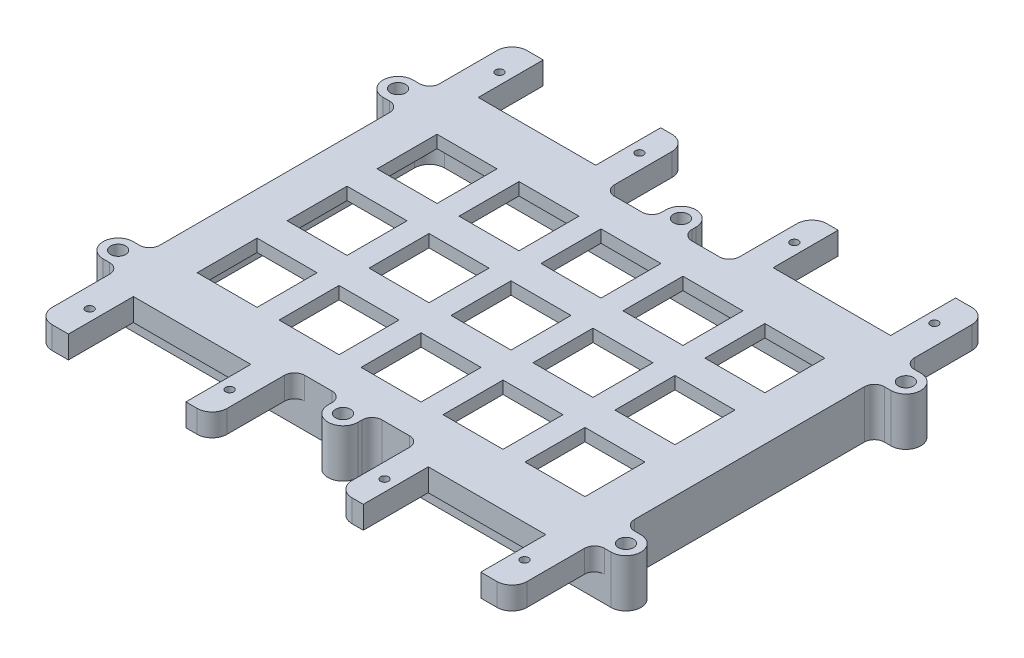
from build123d import *

# Parameters (mm, degrees)
SKETCH_1_R          = 1.5
SKETCH_1_R_2        = 0.8
EXTRUDE_1_DEPTH     = 9.6
CUT_EXTRUDE_START   = -5.1
CUT_EXTRUDE_1_DEPTH = 5.1
SKETCH_3_W          = 90
SKETCH_3_H          = 57
CUT_EXTRUDE_2_DEPTH = 7.1
FILLET_1_R          = 3
FILLET_2_R          = 1
SKETCH_13_W         = 12
SKETCH_13_H         = 12
CUT_EXTRUDE_3_DEPTH = 73.118652234


with BuildPart() as part:
    # 草图1 → 凸台-拉伸1 (new body)
    with BuildSketch(Plane(origin=(0, 0, 0), x_dir=(1, 0, 0), z_dir=(0, 1, 0))):
        with BuildLine():
            Line((-47.5, 23), (-47.5, -23))
            ThreePointArc((-47.5, -23), (-48.085786438, -24.414213562), (-49.5, -25))
            Line((-49.5, -25), (-50.8, -25))
            ThreePointArc((-50.8, -25), (-53.8, -28), (-50.8, -31))
            Line((-50.8, -31), (-49.5, -31))
            ThreePointArc((-49.5, -31), (-48.085786438, -31.585786438), (-47.5, -33))
            Line((-47.5, -33), (-47.5, -44.5))
            ThreePointArc((-47.5, -44.5), (-46.621320344, -46.621320344), (-44.5, -47.5))
            Line((-44.5, -47.5), (-41.25, -47.5))
            Line((-41.25, -47.5), (-41.25, -34.5))
            Line((-41.25, -34.5), (-17.75, -34.5))
            Line((-17.75, -34.5), (-17.75, -47.5))
            Line((-17.75, -47.5), (-15.5, -47.5))
            ThreePointArc((-15.5, -47.5), (-13.378679656, -46.621320344), (-12.5, -44.5))
            Line((-12.5, -44.5), (-12.5, -33))
            ThreePointArc((-12.5, -33), (-11.914213562, -31.585786438), (-10.5, -31))
            Line((-10.5, -31), (-5, -31))
            ThreePointArc((-5, -31), (-3.585786438, -31.585786438), (-3, -33))
            Line((-3, -33), (-3, -33.8))
            ThreePointArc((-3, -33.8), (0, -36.8), (3, -33.8))
            Line((3, -33.8), (3, -33))
            ThreePointArc((3, -33), (3.585786438, -31.585786438), (5, -31))
            Line((5, -31), (10.5, -31))
            ThreePointArc((10.5, -31), (11.914213562, -31.585786438), (12.5, -33))
            Line((12.5, -33), (12.5, -44.5))
            ThreePointArc((12.5, -44.5), (13.378679656, -46.621320344), (15.5, -47.5))
            Line((15.5, -47.5), (17.75, -47.5))
            Line((17.75, -47.5), (17.75, -34.5))
            Line((17.75, -34.5), (41.25, -34.5))
            Line((41.25, -34.5), (41.25, -47.5))
            Line((41.25, -47.5), (44.5, -47.5))
            ThreePointArc((44.5, -47.5), (46.621320344, -46.621320344), (47.5, -44.5))
            Line((47.5, -44.5), (47.5, -33))
            ThreePointArc((47.5, -33), (48.085786438, -31.585786438), (49.5, -31))
            Line((49.5, -31), (50.8, -31))
            ThreePointArc((50.8, -31), (53.8, -28), (50.8, -25))
            Line((50.8, -25), (49.5, -25))
            ThreePointArc((49.5, -25), (48.085786438, -24.414213562), (47.5, -23))
            Line((47.5, -23), (47.5, 23))
            ThreePointArc((47.5, 23), (48.085786438, 24.414213562), (49.5, 25))
            Line((49.5, 25), (50.8, 25))
            ThreePointArc((50.8, 25), (53.8, 28), (50.8, 31))
            Line((50.8, 31), (49.5, 31))
            ThreePointArc((49.5, 31), (48.085786438, 31.585786438), (47.5, 33))
            Line((47.5, 33), (47.5, 44.5))
            ThreePointArc((47.5, 44.5), (46.621320344, 46.621320344), (44.5, 47.5))
            Line((44.5, 47.5), (41.25, 47.5))
            Line((41.25, 47.5), (41.25, 34.5))
            Line((41.25, 34.5), (17.75, 34.5))
            Line((17.75, 34.5), (17.75, 47.5))
            Line((17.75, 47.5), (15.5, 47.5))
            ThreePointArc((15.5, 47.5), (13.378679656, 46.621320344), (12.5, 44.5))
            Line((12.5, 44.5), (12.5, 33))
            ThreePointArc((12.5, 33), (11.914213562, 31.585786438), (10.5, 31))
            Line((10.5, 31), (5, 31))
            ThreePointArc((5, 31), (3.585786438, 31.585786438), (3, 33))
            Line((3, 33), (3, 33.8))
            ThreePointArc((3, 33.8), (0, 36.8), (-3, 33.8))
            Line((-3, 33.8), (-3, 33))
            ThreePointArc((-3, 33), (-3.585786438, 31.585786438), (-5, 31))
            Line((-5, 31), (-10.5, 31))
            ThreePointArc((-10.5, 31), (-11.914213562, 31.585786438), (-12.5, 33))
            Line((-12.5, 33), (-12.5, 44.5))
            ThreePointArc((-12.5, 44.5), (-13.378679656, 46.621320344), (-15.5, 47.5))
            Line((-15.5, 47.5), (-17.75, 47.5))
            Line((-17.75, 47.5), (-17.75, 34.5))
            Line((-17.75, 34.5), (-41.25, 34.5))
            Line((-41.25, 34.5), (-41.25, 47.5))
            Line((-41.25, 47.5), (-44.5, 47.5))
            ThreePointArc((-44.5, 47.5), (-46.621320344, 46.621320344), (-47.5, 44.5))
            Line((-47.5, 44.5), (-47.5, 33))
            ThreePointArc((-47.5, 33), (-48.085786438, 31.585786438), (-49.5, 31))
            Line((-49.5, 31), (-50.8, 31))
            ThreePointArc((-50.8, 31), (-53.8, 28), (-50.8, 25))
            Line((-50.8, 25), (-49.5, 25))
            ThreePointArc((-49.5, 25), (-48.085786438, 24.414213562), (-47.5, 23))
        make_face()
        with Locations(Location((-50.8, 28, 0), (0, 0, 270))):
            Circle(SKETCH_1_R, mode=Mode.SUBTRACT)
        with Locations(Location((50.8, 28, 0), (0, 0, 90))):
            Circle(SKETCH_1_R, mode=Mode.SUBTRACT)
        with Locations(Location((50.8, -28, 0), (0, 0, 270))):
            Circle(SKETCH_1_R, mode=Mode.SUBTRACT)
        with Locations(Location((-50.8, -28, 0), (0, 0, 90))):
            Circle(SKETCH_1_R, mode=Mode.SUBTRACT)
        with Locations(Location((0, 33.8, 0), (0, 0, 270))):
            Circle(SKETCH_1_R, mode=Mode.SUBTRACT)
        with Locations(Location((0, -33.8, 0), (0, 0, 90))):
            Circle(SKETCH_1_R, mode=Mode.SUBTRACT)
        with Locations(Location((43.5, 41, 0), (0, 0, 270))):
            Circle(SKETCH_1_R_2, mode=Mode.SUBTRACT)
        with Locations(Location((15.5, 41, 0), (0, 0, 90))):
            Circle(SKETCH_1_R_2, mode=Mode.SUBTRACT)
        with Locations(Location((43.5, -41, 0), (0, 0, 90))):
            Circle(SKETCH_1_R_2, mode=Mode.SUBTRACT)
        with Locations(Location((15.5, -41, 0), (0, 0, 270))):
            Circle(SKETCH_1_R_2, mode=Mode.SUBTRACT)
        with Locations(Location((-15.5, -41, 0), (0, 0, 90))):
            Circle(SKETCH_1_R_2, mode=Mode.SUBTRACT)
        with Locations(Location((-43.5, -41, 0), (0, 0, 270))):
            Circle(SKETCH_1_R_2, mode=Mode.SUBTRACT)
        with Locations(Location((-43.5, 41, 0), (0, 0, 90))):
            Circle(SKETCH_1_R_2, mode=Mode.SUBTRACT)
        with Locations(Location((-15.5, 41, 0), (0, 0, 270))):
            Circle(SKETCH_1_R_2, mode=Mode.SUBTRACT)
    extrude(amount=-EXTRUDE_1_DEPTH)

    # 草图2 → 切除-拉伸1 (cut)
    with BuildSketch(Plane.XZ.offset(9.6).offset(CUT_EXTRUDE_START)):
        with BuildLine():
            Line((63.557901373, 31), (5, 31))
            ThreePointArc((5, 31), (3.585786438, 31.585786438), (3, 33))
            Line((3, 33), (3, 33.8))
            ThreePointArc((3, 33.8), (0, 36.8), (-3, 33.8))
            Line((-3, 33.8), (-3, 33))
            ThreePointArc((-3, 33), (-3.585786438, 31.585786438), (-5, 31))
            Line((-5, 31), (-73.010332056, 31))
            Line((-73.010332056, 31), (-73.010332056, 53.694218021))
            Line((-73.010332056, 53.694218021), (63.557901373, 53.694218021))
            Line((63.557901373, 53.694218021), (63.557901373, 31))
        make_face()
        with BuildLine():
            Line((63.557901373, -31), (63.557901373, -53.694218021))
            Line((63.557901373, -53.694218021), (-73.010332056, -53.694218021))
            Line((-73.010332056, -53.694218021), (-73.010332056, -31))
            Line((-73.010332056, -31), (-5, -31))
            ThreePointArc((-5, -31), (-3.585786438, -31.585786438), (-3, -33))
            Line((-3, -33), (-3, -33.8))
            ThreePointArc((-3, -33.8), (0, -36.8), (3, -33.8))
            Line((3, -33.8), (3, -33))
            ThreePointArc((3, -33), (3.585786438, -31.585786438), (5, -31))
            Line((5, -31), (63.557901373, -31))
        make_face()
    extrude(amount=CUT_EXTRUDE_1_DEPTH, mode=Mode.SUBTRACT)

    # 草图3 → 切除-拉伸2 (cut)
    with BuildSketch(Plane.XZ.offset(9.6)):
        Rectangle(SKETCH_3_W, SKETCH_3_H)
    extrude(amount=-CUT_EXTRUDE_2_DEPTH, mode=Mode.SUBTRACT)

    # 圆角1
    fillet_1_edges = [part.edges().sort_by_distance(p)[0] for p in [
        (45, -6.05, 28.5),
        (45, -6.05, -28.5),
        (-45, -6.05, -28.5),
        (-45, -6.05, 28.5),
    ]]
    fillet(fillet_1_edges, radius=FILLET_1_R)

    # 圆角2
    fillet_2_edges = [part.edges().sort_by_distance(p)[0] for p in [
        (0, -2.5, -28.5),
        (-45, -2.5, 0),
        (45, -2.5, 0),
        (0, -2.5, 28.5),
        (44.121320344, -2.5, 27.621320344),
        (44.121320344, -2.5, -27.621320344),
        (-44.121320344, -2.5, 27.621320344),
        (-44.121320344, -2.5, -27.621320344),
    ]]
    fillet(fillet_2_edges, radius=FILLET_2_R)

    # 草图13 → 切除-拉伸3 (cut, through all)
    with BuildSketch(Plane.XZ.offset(2.5)):
        with Locations((-33, 18)):
            Rectangle(SKETCH_13_W, SKETCH_13_H)
        with Locations((-16.6, 18)):
            Rectangle(SKETCH_13_W, SKETCH_13_H)
        with Locations((-0.2, 18)):
            Rectangle(SKETCH_13_W, SKETCH_13_H)
        with Locations((16.2, 18)):
            Rectangle(SKETCH_13_W, SKETCH_13_H)
        with Locations((32.6, 18)):
            Rectangle(SKETCH_13_W, SKETCH_13_H)
        with Locations((-16.6, 0)):
            Rectangle(SKETCH_13_W, SKETCH_13_H)
        with Locations((-0.2, 0)):
            Rectangle(SKETCH_13_W, SKETCH_13_H)
        with Locations((16.2, 0)):
            Rectangle(SKETCH_13_W, SKETCH_13_H)
        with Locations((32.6, 0)):
            Rectangle(SKETCH_13_W, SKETCH_13_H)
        with Locations((-16.6, -18)):
            Rectangle(SKETCH_13_W, SKETCH_13_H)
        with Locations((-0.2, -18)):
            Rectangle(SKETCH_13_W, SKETCH_13_H)
        with Locations((16.2, -18)):
            Rectangle(SKETCH_13_W, SKETCH_13_H)
        with Locations((32.6, -18)):
            Rectangle(SKETCH_13_W, SKETCH_13_H)
        with Locations((-33, 0)):
            Rectangle(SKETCH_13_W, SKETCH_13_H)
        with Locations((-33, -18)):
            Rectangle(SKETCH_13_W, SKETCH_13_H)
    extrude(amount=-CUT_EXTRUDE_3_DEPTH, mode=Mode.SUBTRACT)


solid = part.part
